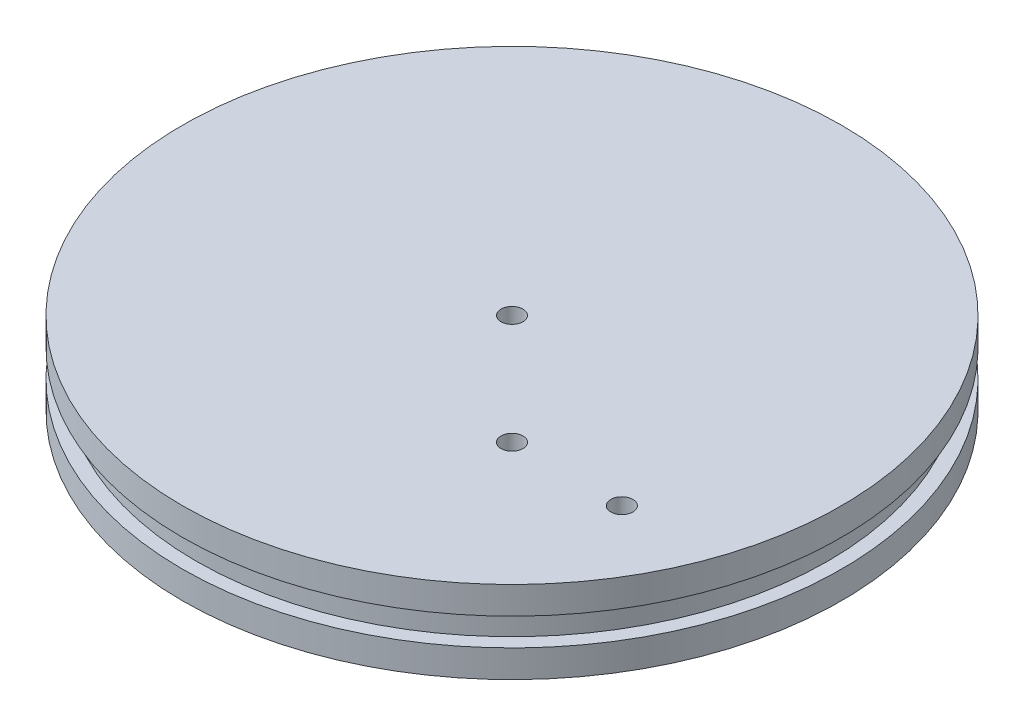
from build123d import *

# Parameters (mm, degrees)
SKETCH1_R           = 76.2
SKETCH1_R_2         = 2.54
BOSS_EXTRUDE1_DEPTH = 19.05
SKETCH2_W           = 3.175
SKETCH2_H           = 6.35


with BuildPart() as part:
    # Sketch1 → Boss-Extrude1 (new body)
    with BuildSketch(Plane(origin=(0, 0, 0), x_dir=(1, 0, 0), z_dir=(0, 1, 0))):
        with Locations(Location((0, 0, 0), (0, 0, 90))):
            Circle(SKETCH1_R)
        with Locations(Location((0, 0, 0), (0, 0, 90))):
            Circle(SKETCH1_R_2, mode=Mode.SUBTRACT)
        with Locations(Location((25.4, -25.4, 0), (0, 0, 90))):
            Circle(SKETCH1_R_2, mode=Mode.SUBTRACT)
        with Locations(Location((50.8, -25.4, 0), (0, 0, 90))):
            Circle(SKETCH1_R_2, mode=Mode.SUBTRACT)
    extrude(amount=BOSS_EXTRUDE1_DEPTH)

    # Sketch2 → Cut-Revolve1 (revolve, cut)
    with BuildSketch(Plane.XY, mode=Mode.PRIVATE) as cut_revolve1_sk:
        with Locations((-74.6125, 9.525)):
            Rectangle(SKETCH2_W, SKETCH2_H)
    revolve(cut_revolve1_sk.sketch.rotate(Axis((0, 4.7625, 0), (0, 1, 0)), 270), axis=Axis((0, 4.7625, 0), (0, 1, 0)), mode=Mode.SUBTRACT)


solid = part.part
